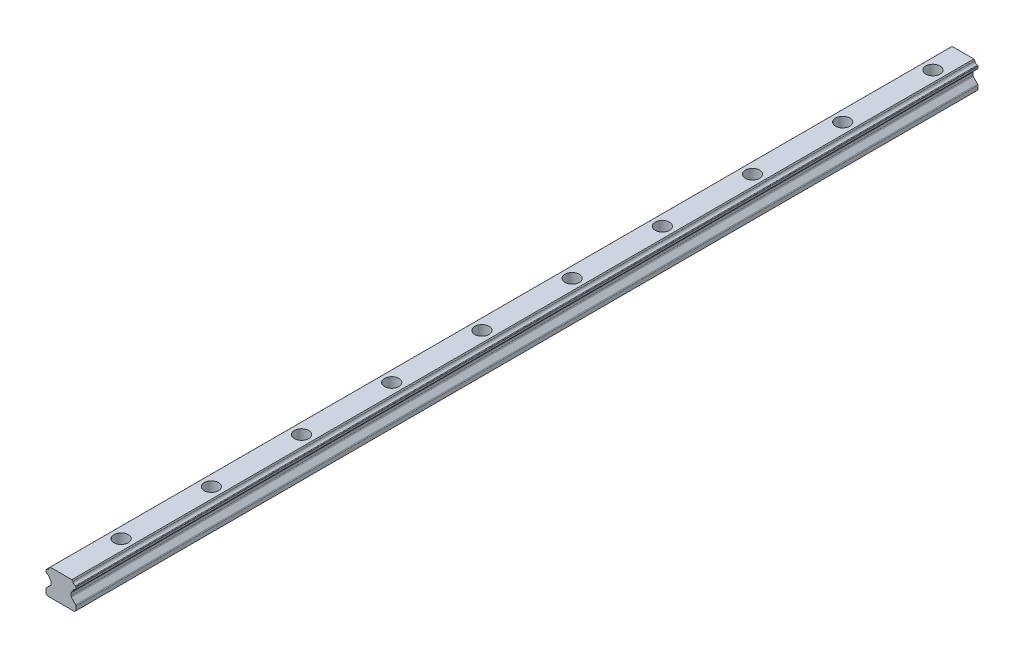
from build123d import *

# Parameters (mm, degrees)
BOSS_EXTRUDE1_DEPTH                     = 600
CBORE_FOR_M5_HEX_HEAD_BOLT1_D           = 6
CBORE_FOR_M5_HEX_HEAD_BOLT1_CBORE_D     = 9.5
CBORE_FOR_M5_HEX_HEAD_BOLT1_CBORE_DEPTH = 8.5


with BuildPart() as part:
    # Model → Boss-Extrude1 (new body)
    with BuildSketch(Plane.XY):
        with BuildLine():
            Line((-9, 0), (-10, 1))
            Line((-10, 1), (-10, 3.656507))
            ThreePointArc((-10, 3.656507), (-9.923879652, 4.039190515), (-9.707107, 4.363614))
            Line((-9.707107, 4.363614), (-6.892893, 7.177827))
            ThreePointArc((-6.892893, 7.177827), (-6.676120348, 7.502250485), (-6.6, 7.884934))
            Line((-6.6, 7.884934), (-6.6, 9.445065))
            ThreePointArc((-6.6, 9.445065), (-6.676120133, 9.827749063), (-6.892893, 10.152173))
            Line((-6.892893, 10.152173), (-7.630162, 10.889441))
            ThreePointArc((-7.630162, 10.889441), (-7.773916111, 11.035785789), (-7.846806076, 11.22753848))
            ThreePointArc((-7.846806076, 11.22753848), (-8.396387934, 12.262927951), (-9.431777507, 12.812509617))
            ThreePointArc((-9.431777507, 12.812509617), (-9.571493724, 12.861817566), (-9.690626, 12.949905))
            Line((-9.690626, 12.949905), (-9.853554, 13.112833))
            ThreePointArc((-9.853554, 13.112833), (-9.961939973, 13.275044564), (-10, 13.466386))
            Line((-10, 13.466386), (-10, 14.523614))
            ThreePointArc((-10, 14.523614), (-9.961940015, 14.714955453), (-9.853554, 14.877167))
            Line((-9.853554, 14.877167), (-9.678501, 15.052219))
            ThreePointArc((-9.678501, 15.052219), (-9.560417777, 15.139748282), (-9.421985167, 15.189159165))
            ThreePointArc((-9.421985167, 15.189159165), (-8.395921393, 15.736919214), (-7.848161791, 16.762983227))
            ThreePointArc((-7.848161791, 16.762983227), (-7.775191189, 16.953001466), (-7.632531, 17.09819))
            Line((-7.632531, 17.09819), (-7.230721, 17.5))
            Line((-7.230721, 17.5), (7.230721, 17.5))
            Line((7.230721, 17.5), (7.632531, 17.09819))
            ThreePointArc((7.632531, 17.09819), (7.775191683, 16.953001656), (7.848162914, 16.762983433))
            ThreePointArc((7.848162914, 16.762983433), (8.395922282, 15.736920132), (9.421985254, 15.189160148))
            ThreePointArc((9.421985254, 15.189160148), (9.560417914, 15.139748806), (9.678501, 15.052219))
            Line((9.678501, 15.052219), (9.853554, 14.877167))
            ThreePointArc((9.853554, 14.877167), (9.961939973, 14.714955436), (10, 14.523614))
            Line((10, 14.523614), (10, 13.466386))
            ThreePointArc((10, 13.466386), (9.961940015, 13.275044547), (9.853554, 13.112833))
            Line((9.853554, 13.112833), (9.690626, 12.949905))
            ThreePointArc((9.690626, 12.949905), (9.571494062, 12.861817368), (9.431778146, 12.812509028))
            ThreePointArc((9.431778146, 12.812509028), (8.39638873, 12.262927298), (7.846806979, 11.227537892))
            ThreePointArc((7.846806979, 11.227537892), (7.77391648, 11.035785414), (7.630162, 10.889441))
            Line((7.630162, 10.889441), (6.892893, 10.152173))
            ThreePointArc((6.892893, 10.152173), (6.676120157, 9.827749053), (6.6, 9.445065))
            Line((6.6, 9.445065), (6.6, 7.884934))
            ThreePointArc((6.6, 7.884934), (6.676120325, 7.502250475), (6.892893, 7.177827))
            Line((6.892893, 7.177827), (9.707107, 4.363614))
            ThreePointArc((9.707107, 4.363614), (9.923879675, 4.039190525), (10, 3.656507))
            Line((10, 3.656507), (10, 1))
            Line((10, 1), (9, 0))
            Line((9, 0), (-9, 0))
        make_face()
    extrude(amount=BOSS_EXTRUDE1_DEPTH)

    # CBORE for M5 Hex Head Bolt1 (through all)
    with Locations(Plane(origin=(0, 17.5, 0), x_dir=(1, 0, 0), z_dir=(0, 1, 0))):
        with Locations((0, -20), (0, -80), (0, -140), (0, -200), (0, -260), (0, -320), (0, -380), (0, -440), (0, -500), (0, -560), (0, -620), (0, -680), (0, -740), (0, -800), (0, -860), (0, -920), (0, -980)):
            CounterBoreHole(CBORE_FOR_M5_HEX_HEAD_BOLT1_D / 2, CBORE_FOR_M5_HEX_HEAD_BOLT1_CBORE_D / 2, CBORE_FOR_M5_HEX_HEAD_BOLT1_CBORE_DEPTH)


solid = part.part
